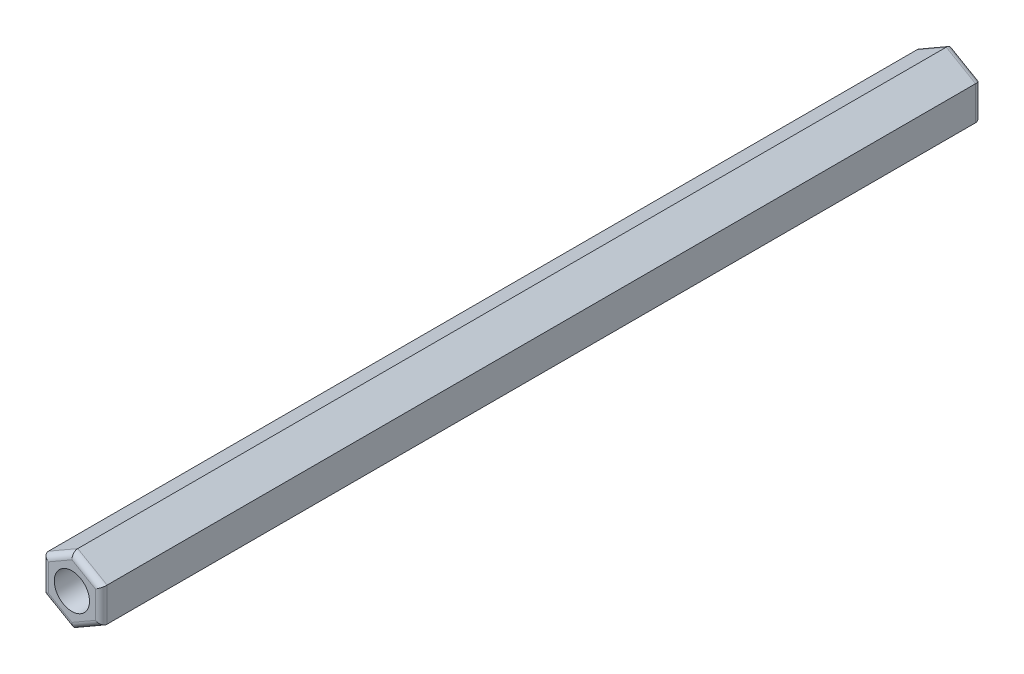
from build123d import *

# Parameters (mm, degrees)
RESSALTO_EXTRUS_O1_DEPTH = 75
FILETE1_R                = 0.5
ESBO_O2_R                = 1.5
CORTE_EXTRUS_O1_DEPTH    = 105.354641132


with BuildPart() as part:
    # Esboço1 → Ressalto-extrusão1 (new body)
    with BuildSketch(Plane(origin=(0, 0, 0), x_dir=(-1, 0, 0), z_dir=(0, 0, -1))):
        Polygon((67.502122675, -1.443375673), (70.002122675, -2.886751346), (72.502122675, -1.443375673), (72.502122675, 1.443375673), (70.002122675, 2.886751346), (67.502122675, 1.443375673), align=None)
    extrude(amount=-RESSALTO_EXTRUS_O1_DEPTH)

    # Filete1
    filete1_edges = [part.edges().sort_by_distance(p)[0] for p in [
        (-71.252122675, -2.165063509, 75),
        (-72.502122675, 0, 75),
        (-71.252122675, 2.165063509, 75),
        (-68.752122675, 2.165063509, 75),
        (-67.502122675, 0, 75),
        (-68.752122675, 2.165063509, 0),
        (-71.252122675, 2.165063509, 0),
        (-72.502122675, 0, 0),
        (-71.252122675, -2.165063509, 0),
        (-68.752122675, -2.165063509, 0),
        (-67.502122675, 0, 0),
        (-68.752122675, -2.165063509, 75),
    ]]
    fillet(filete1_edges, radius=FILETE1_R)

    # Esboço2 → Corte-extrusão1 (cut, through all)
    with BuildSketch(Plane.XY.offset(75)):
        with Locations((-70.002122675, 0)):
            Circle(ESBO_O2_R)
    extrude(amount=-CORTE_EXTRUS_O1_DEPTH, mode=Mode.SUBTRACT)


solid = part.part
